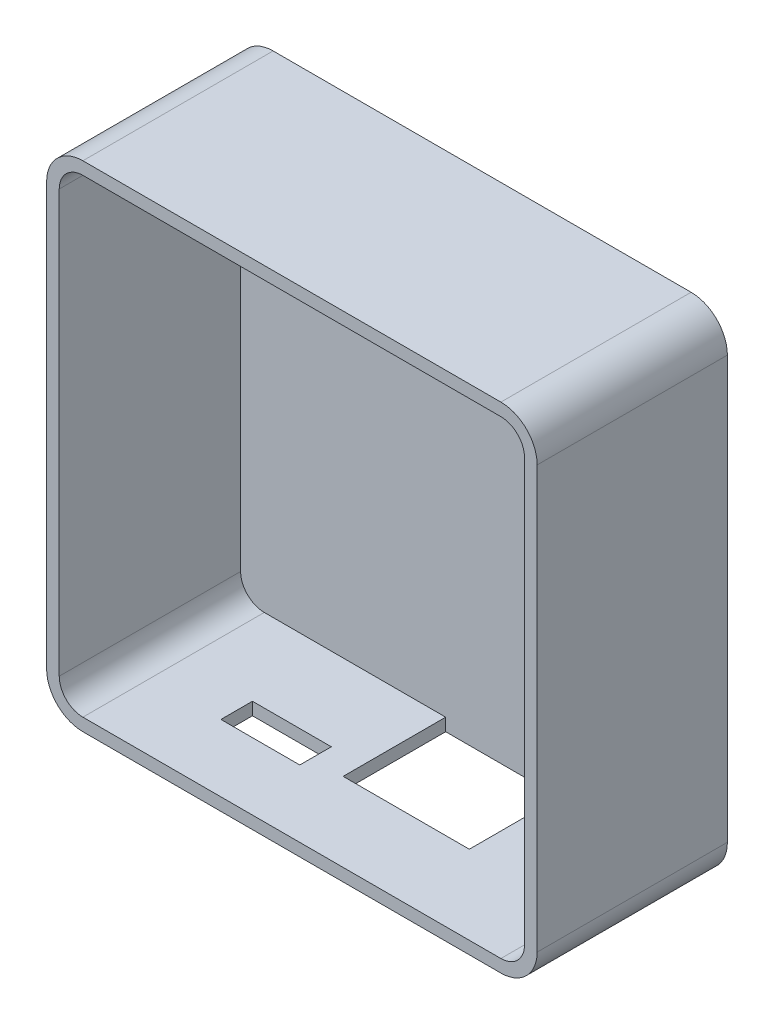
from build123d import *

# Parameters (mm, degrees)
PARED_DEPTH             = 23
CONECTORES_REACH        = 92.181
CROQUIS2_W              = 16
CROQUIS2_H              = 13
CROQUIS2_W_2            = 10
CROQUIS2_H_2            = 4
BASE_START              = -1.12
BASE_FRENTE_DEPTH       = 1.12
LUCES_REACH             = 91.076
CROQUIS3_R              = 1.5
CROQUIS3_R_2            = 2.5
SALIENTE_EXTRUIR1_START = 12
CROQUIS3_3_R            = 2.3
CROQUIS3_3_R_2          = 1.5
SALIENTE_EXTRUIR1_DEPTH = 12
SALIENTE_EXTRUIR2_START = 9
CROQUIS3_4_R            = 3.3
CROQUIS3_4_R_2          = 2.5
SALIENTE_EXTRUIR2_DEPTH = 9


with BuildPart() as part:
    # Croquis1 → pared (new body)
    with BuildSketch(Plane.XY):
        with BuildLine():
            Line((3, 61.1), (56, 61.1))
            ThreePointArc((56, 61.1), (59.252691193, 59.752691193), (60.6, 56.5))
            Line((60.6, 56.5), (60.6, 3))
            ThreePointArc((60.6, 3), (59.252691193, -0.252691193), (56, -1.6))
            Line((56, -1.6), (3, -1.6))
            ThreePointArc((3, -1.6), (-0.252691193, -0.252691193), (-1.6, 3))
            Line((-1.6, 3), (-1.6, 56.5))
            ThreePointArc((-1.6, 56.5), (-0.252691193, 59.752691193), (3, 61.1))
        make_face()
        with BuildLine():
            Line((3, 0), (56, 0))
            ThreePointArc((56, 0), (58.121320344, 0.878679656), (59, 3))
            Line((59, 3), (59, 56.5))
            ThreePointArc((59, 56.5), (58.121320344, 58.621320344), (56, 59.5))
            Line((56, 59.5), (3, 59.5))
            ThreePointArc((3, 59.5), (0.878679656, 58.621320344), (0, 56.5))
            Line((0, 56.5), (0, 3))
            ThreePointArc((0, 3), (0.878679656, 0.878679656), (3, 0))
        make_face(mode=Mode.SUBTRACT)
    extrude(amount=PARED_DEPTH)

    # Croquis2 → conectores (cut, up to next)
    with BuildSketch(Plane.XZ.offset(1.6), mode=Mode.PRIVATE) as conectores_sk1:
        with Locations((34, 6.5)):
            Rectangle(CROQUIS2_W, CROQUIS2_H)
    conectores_tool1 = extrude(conectores_sk1.sketch, amount=-CONECTORES_REACH, mode=Mode.PRIVATE) & part.part
    # Croquis2 → conectores (cut, up to next)
    with BuildSketch(Plane.XZ.offset(1.6), mode=Mode.PRIVATE) as conectores_sk2:
        with Locations((17, 12.5)):
            Rectangle(CROQUIS2_W_2, CROQUIS2_H_2)
    conectores_tool2 = extrude(conectores_sk2.sketch, amount=-CONECTORES_REACH, mode=Mode.PRIVATE) & part.part
    add(conectores_tool1.solids().sort_by_distance((34, -1.6, 6.5))[0], mode=Mode.SUBTRACT)
    add(conectores_tool2.solids().sort_by_distance((17, -1.6, 12.5))[0], mode=Mode.SUBTRACT)

    # Croquis1<2> → base frente (add)
    with BuildSketch(Plane.XY.offset(BASE_START)):
        with BuildLine():
            Line((3, 61.1), (56, 61.1))
            ThreePointArc((56, 61.1), (59.252691193, 59.752691193), (60.6, 56.5))
            Line((60.6, 56.5), (60.6, 3))
            ThreePointArc((60.6, 3), (59.252691193, -0.252691193), (56, -1.6))
            Line((56, -1.6), (3, -1.6))
            ThreePointArc((3, -1.6), (-0.252691193, -0.252691193), (-1.6, 3))
            Line((-1.6, 3), (-1.6, 56.5))
            ThreePointArc((-1.6, 56.5), (-0.252691193, 59.752691193), (3, 61.1))
        make_face()
    extrude(amount=BASE_FRENTE_DEPTH)

    # Croquis3 → luces (cut, up to next)
    with BuildSketch(Plane.XY, mode=Mode.PRIVATE) as luces_sk1:
        with Locations((54.5, 48)):
            Circle(CROQUIS3_R)
    luces_tool1 = extrude(luces_sk1.sketch, amount=-LUCES_REACH, mode=Mode.PRIVATE) & part.part
    # Croquis3 → luces (cut, up to next)
    with BuildSketch(Plane.XY, mode=Mode.PRIVATE) as luces_sk2:
        with Locations((54.5, 41.5)):
            Circle(CROQUIS3_R)
    luces_tool2 = extrude(luces_sk2.sketch, amount=-LUCES_REACH, mode=Mode.PRIVATE) & part.part
    # Croquis3 → luces (cut, up to next)
    with BuildSketch(Plane.XY, mode=Mode.PRIVATE) as luces_sk3:
        with Locations((54.5, 35)):
            Circle(CROQUIS3_R)
    luces_tool3 = extrude(luces_sk3.sketch, amount=-LUCES_REACH, mode=Mode.PRIVATE) & part.part
    # Croquis3 → luces (cut, up to next)
    with BuildSketch(Plane.XY, mode=Mode.PRIVATE) as luces_sk4:
        with Locations((54.5, 28.5)):
            Circle(CROQUIS3_R)
    luces_tool4 = extrude(luces_sk4.sketch, amount=-LUCES_REACH, mode=Mode.PRIVATE) & part.part
    # Croquis3 → luces (cut, up to next)
    with BuildSketch(Plane.XY, mode=Mode.PRIVATE) as luces_sk5:
        with Locations((54.5, 17.5)):
            Circle(CROQUIS3_R)
    luces_tool5 = extrude(luces_sk5.sketch, amount=-LUCES_REACH, mode=Mode.PRIVATE) & part.part
    # Croquis3 → luces (cut, up to next)
    with BuildSketch(Plane.XY, mode=Mode.PRIVATE) as luces_sk6:
        with Locations((54.5, 11.5)):
            Circle(CROQUIS3_R_2)
    luces_tool6 = extrude(luces_sk6.sketch, amount=-LUCES_REACH, mode=Mode.PRIVATE) & part.part
    add(luces_tool1.solids().sort_by_distance((54.5, 48, 0))[0], mode=Mode.SUBTRACT)
    add(luces_tool2.solids().sort_by_distance((54.5, 41.5, 0))[0], mode=Mode.SUBTRACT)
    add(luces_tool3.solids().sort_by_distance((54.5, 35, 0))[0], mode=Mode.SUBTRACT)
    add(luces_tool4.solids().sort_by_distance((54.5, 28.5, 0))[0], mode=Mode.SUBTRACT)
    add(luces_tool5.solids().sort_by_distance((54.5, 17.5, 0))[0], mode=Mode.SUBTRACT)
    add(luces_tool6.solids().sort_by_distance((54.5, 11.5, 0))[0], mode=Mode.SUBTRACT)

    # Croquis3<3> → Saliente-Extruir1 (add)
    # profile 1 of 5: a face of its own
    with BuildSketch(Plane.XY.offset(SALIENTE_EXTRUIR1_START)):
        with Locations((54.5, 48)):
            Circle(CROQUIS3_3_R)
        with Locations((54.5, 48)):
            Circle(CROQUIS3_3_R_2, mode=Mode.SUBTRACT)
    # profile 2 of 5: a face of its own
    with BuildSketch(Plane.XY.offset(SALIENTE_EXTRUIR1_START)):
        with Locations((54.5, 41.5)):
            Circle(CROQUIS3_3_R)
        with Locations((54.5, 41.5)):
            Circle(CROQUIS3_3_R_2, mode=Mode.SUBTRACT)
    # profile 3 of 5: a face of its own
    with BuildSketch(Plane.XY.offset(SALIENTE_EXTRUIR1_START)):
        with Locations((54.5, 35)):
            Circle(CROQUIS3_3_R)
        with Locations((54.5, 35)):
            Circle(CROQUIS3_3_R_2, mode=Mode.SUBTRACT)
    # profile 4 of 5: a face of its own
    with BuildSketch(Plane.XY.offset(SALIENTE_EXTRUIR1_START)):
        with Locations((54.5, 28.5)):
            Circle(CROQUIS3_3_R)
        with Locations((54.5, 28.5)):
            Circle(CROQUIS3_3_R_2, mode=Mode.SUBTRACT)
    # profile 5 of 5: a face of its own
    with BuildSketch(Plane.XY.offset(SALIENTE_EXTRUIR1_START)):
        with Locations((54.5, 17.5)):
            Circle(CROQUIS3_3_R)
        with Locations((54.5, 17.5)):
            Circle(CROQUIS3_3_R_2, mode=Mode.SUBTRACT)
    extrude(amount=-SALIENTE_EXTRUIR1_DEPTH)

    # Croquis3<4> → Saliente-Extruir2 (add)
    with BuildSketch(Plane.XY.offset(SALIENTE_EXTRUIR2_START)):
        with Locations((54.5, 11.5)):
            Circle(CROQUIS3_4_R)
        with Locations((54.5, 11.5)):
            Circle(CROQUIS3_4_R_2, mode=Mode.SUBTRACT)
    extrude(amount=-SALIENTE_EXTRUIR2_DEPTH)


solid = part.part
